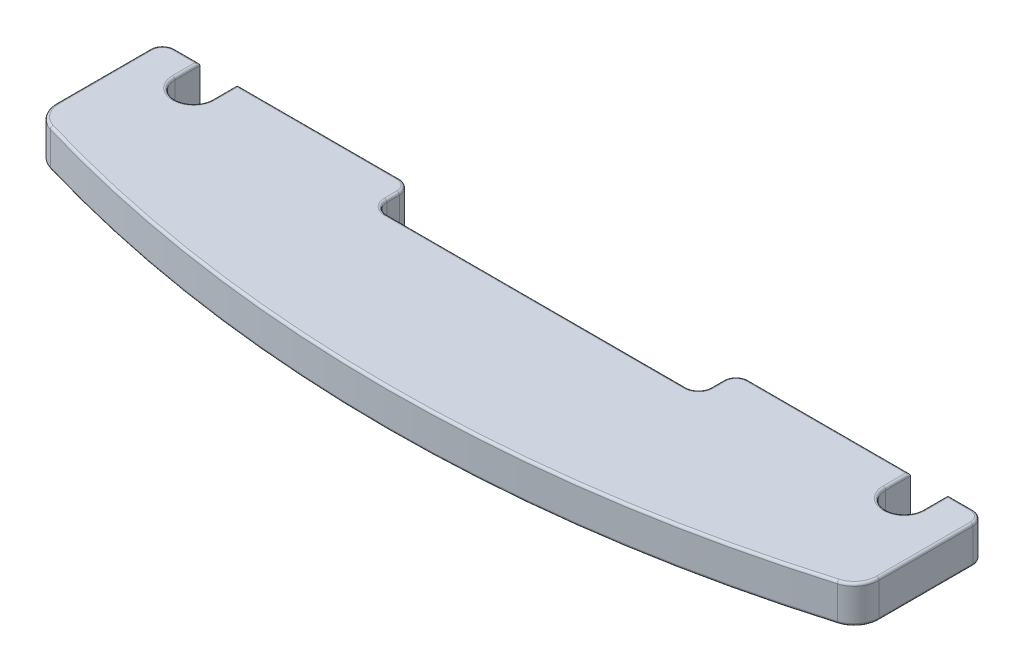
from build123d import *

# Parameters (mm, degrees)
BOSS_EXTRUDE1_DEPTH = 3
FILLET1_R           = 0.2


with BuildPart() as part:
    # Sketch1 → Boss-Extrude1 (new body)
    with BuildSketch(Plane(origin=(0, 0, 0), x_dir=(1, 0, 0), z_dir=(0, 1, 0))):
        with BuildLine():
            Line((-33, 14), (-33, 6.484033627))
            ThreePointArc((-33, 6.484033627), (-32.602100997, 5.286840077), (-31.566727605, 4.566008648))
            ThreePointArc((-31.566727605, 4.566008648), (0, 0), (31.566727605, 4.566008648))
            ThreePointArc((31.566727605, 4.566008648), (32.602100997, 5.286840077), (33, 6.484033627))
            Line((33, 6.484033627), (33, 14))
            ThreePointArc((33, 14), (32.707106781, 14.707106781), (32, 15))
            Line((32, 15), (30, 15))
            Line((30, 15), (30, 13))
            ThreePointArc((30, 13), (28.5, 11.5), (27, 13))
            Line((27, 13), (27, 15))
            Line((27, 15), (14, 15))
            ThreePointArc((14, 15), (13.292893219, 14.707106781), (13, 14))
            Line((13, 14), (13, 13))
            ThreePointArc((13, 13), (12.707106781, 12.292893219), (12, 12))
            Line((12, 12), (-12, 12))
            ThreePointArc((-12, 12), (-12.707106781, 12.292893219), (-13, 13))
            Line((-13, 13), (-13, 14))
            ThreePointArc((-13, 14), (-13.292893219, 14.707106781), (-14, 15))
            Line((-14, 15), (-27, 15))
            Line((-27, 15), (-27, 13))
            ThreePointArc((-27, 13), (-28.5, 11.5), (-30, 13))
            Line((-30, 13), (-30, 15))
            Line((-30, 15), (-32, 15))
            ThreePointArc((-32, 15), (-32.707106781, 14.707106781), (-33, 14))
        make_face()
    extrude(amount=BOSS_EXTRUDE1_DEPTH)

    # Fillet1
    fillet1_edges = [part.edges().sort_by_distance(p)[0] for p in [
        (-13.292893219, 3, -14.707106781),
        (-20.5, 3, -15),
        (-27, 3, -14),
        (-28.5, 3, -11.5),
        (0, 0, -12),
        (12.707106781, 0, -12.292893219),
        (13, 0, -13.5),
        (13.292893219, 0, -14.707106781),
        (-30, 3, -14),
        (20.5, 0, -15),
        (27, 0, -14),
        (28.5, 0, -11.5),
        (30, 0, -14),
        (31, 0, -15),
        (32.707106781, 0, -14.707106781),
        (33, 0, -10.242016813),
        (32.602100997, 0, -5.286840077),
        (-31, 3, -15),
        (0, 0, 0),
        (-32.602100997, 0, -5.286840077),
        (-33, 0, -10.242016813),
        (-32.707106781, 0, -14.707106781),
        (-31, 0, -15),
        (-30, 0, -14),
        (-28.5, 0, -11.5),
        (-32.707106781, 3, -14.707106781),
        (-27, 0, -14),
        (-20.5, 0, -15),
        (-13.292893219, 0, -14.707106781),
        (-13, 0, -13.5),
        (-12.707106781, 0, -12.292893219),
        (-33, 3, -10.242016813),
        (-32.602100997, 3, -5.286840077),
        (0, 3, 0),
        (-12.707106781, 3, -12.292893219),
        (32.602100997, 3, -5.286840077),
        (33, 3, -10.242016813),
        (32.707106781, 3, -14.707106781),
        (31, 3, -15),
        (30, 3, -14),
        (28.5, 3, -11.5),
        (27, 3, -14),
        (20.5, 3, -15),
        (13.292893219, 3, -14.707106781),
        (13, 3, -13.5),
        (-13, 3, -13.5),
        (12.707106781, 3, -12.292893219),
        (0, 3, -12),
    ]]
    fillet(fillet1_edges, radius=FILLET1_R)


solid = part.part
